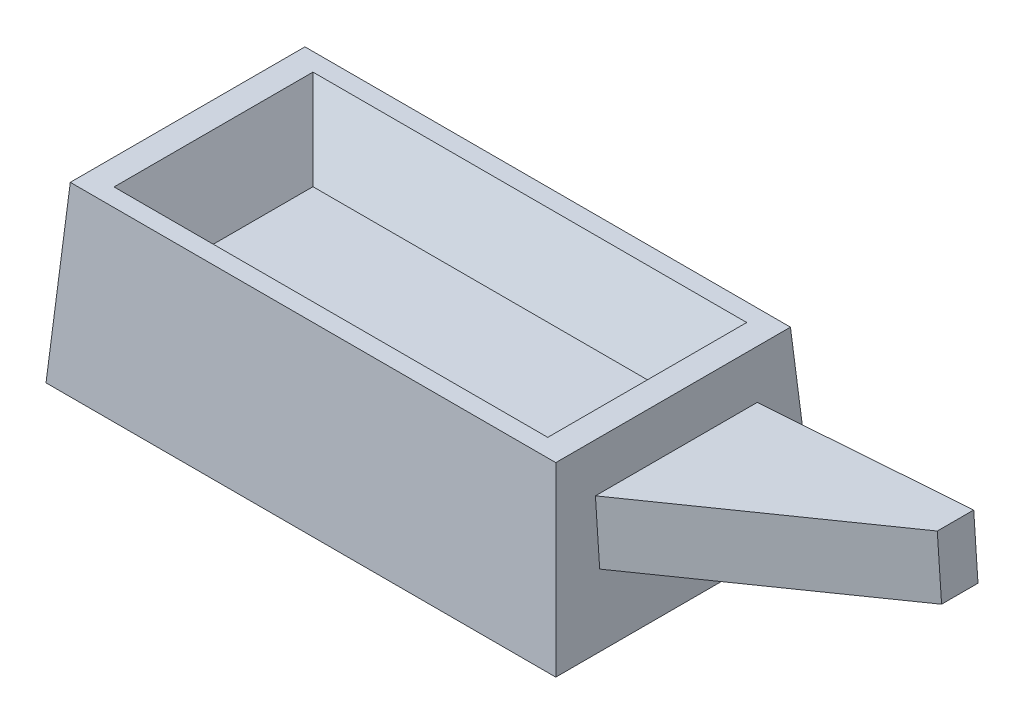
from build123d import *

# Parameters (mm, degrees)
SKETCH1_W           = 205.785682804
SKETCH1_H           = 104.534748446
BOSS_EXTRUDE1_DEPTH = 70.104
BOSS_EXTRUDE1_TAPER = 4
SKETCH2_W           = 145.758865666
SKETCH2_H           = 50.974097726
CUT_EXTRUDE1_DEPTH  = 25.4
SKETCH3_W           = 65.29816474
SKETCH3_H           = 24.799651417
BOSS_EXTRUDE2_DEPTH = 87.63
DRAFT1_ANGLE        = 30
DRAFT2_ANGLE        = 30


with BuildPart() as part:
    # Sketch1 → Boss-Extrude1 (new body)
    with BuildSketch(Plane(origin=(0, 0, 0), x_dir=(1, 0, 0), z_dir=(0, 1, 0))):
        Rectangle(SKETCH1_W, SKETCH1_H)
    extrude(amount=BOSS_EXTRUDE1_DEPTH, taper=BOSS_EXTRUDE1_TAPER)

    # Sketch2 → Cut-Extrude1 (cut)
    with BuildSketch(Plane(origin=(0, 70.104, 0), x_dir=(1, 0, 0), z_dir=(0, 1, 0))):
        Rectangle(SKETCH2_W, SKETCH2_H)
    extrude(amount=-CUT_EXTRUDE1_DEPTH, mode=Mode.SUBTRACT)

    # Sketch3 → Boss-Extrude2 (add)
    with BuildSketch(Plane(origin=(102.392168372, 7.159957902, 0), x_dir=(0, 0, -1), z_dir=(0.9975640502598242, 0.06975647374412534, 0))):
        with Locations((0, 32.321763147)):
            Rectangle(SKETCH3_W, SKETCH3_H)
    extrude(amount=BOSS_EXTRUDE2_DEPTH)

    # Draft1
    draft1_faces = [part.faces().sort_by_distance(p)[0] for p in [
        (0, 57.404, 25.487048863),
        (72.879432833, 57.404, 0),
        (0, 57.404, -25.487048863),
        (-72.879432833, 57.404, 0),
    ]]
    draft(draft1_faces, Plane.ZX.offset(44.704), DRAFT1_ANGLE)

    # Draft2
    draft2_faces = [part.faces().sort_by_distance(p)[0] for p in [
        (143.845785012, 42.459366756, 32.64908237),
    ]]
    draft(draft2_faces, Plane(origin=(102.892841402, 0, 52.267374223), x_dir=(-0.06975647374412534, 0.9975640502598243, 0), z_dir=(0.9975640502598243, 0.06975647374412534, 0)), DRAFT2_ANGLE)


solid = part.part
